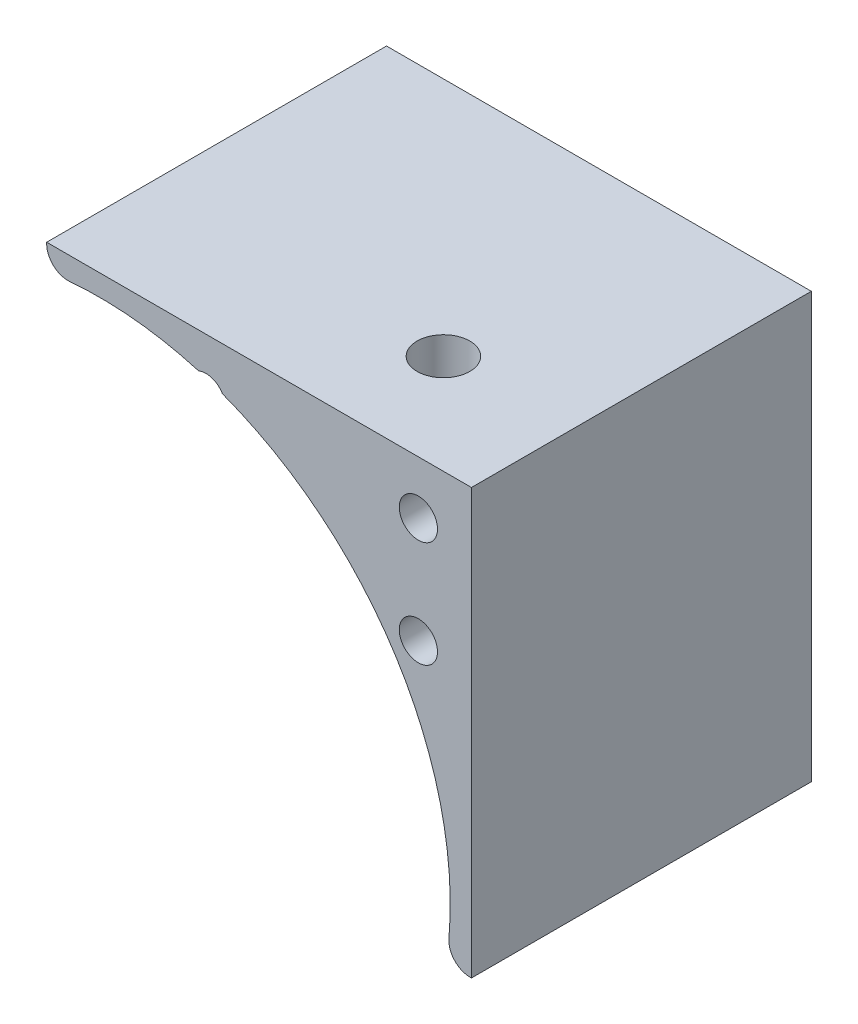
from build123d import *

# Parameters (mm, degrees)
SKETCH1_W           = 50.8
SKETCH1_H           = 50.8
BOSS_EXTRUDE1_DEPTH = 40.64
SKETCH2_R           = 41.91
CUT_EXTRUDE1_DEPTH  = 26.67
SKETCH3_R           = 29.21
CUT_EXTRUDE2_DEPTH  = 83.540230191
SKETCH4_R           = 2.286
CUT_EXTRUDE3_DEPTH  = 83.540230191
FILLET1_R           = 2.54
SKETCH5_R           = 3.154327094
CUT_EXTRUDE4_DEPTH  = 83.540230191


with BuildPart() as part:
    # Sketch1 → Boss-Extrude1 (new body)
    with BuildSketch(Plane.XY):
        with Locations((25.4, 25.4)):
            Rectangle(SKETCH1_W, SKETCH1_H)
    extrude(amount=BOSS_EXTRUDE1_DEPTH)

    # Sketch2 → Cut-Extrude1 (cut)
    with BuildSketch(Plane.XY.offset(40.64)):
        with Locations((6.35, 6.35)):
            Circle(SKETCH2_R)
    extrude(amount=-CUT_EXTRUDE1_DEPTH, mode=Mode.SUBTRACT)

    # Sketch3 → Cut-Extrude2 (cut, through all)
    with BuildSketch(Plane(origin=(0, 0, 0), x_dir=(-1, 0, 0), z_dir=(0, 0, -1))):
        with Locations((-6.35, 6.35)):
            Circle(SKETCH3_R)
    extrude(amount=-CUT_EXTRUDE2_DEPTH, mode=Mode.SUBTRACT)

    # Sketch4 → Cut-Extrude3 (cut, through all)
    with BuildSketch(Plane(origin=(0, 0, 0), x_dir=(-1, 0, 0), z_dir=(0, 0, -1))):
        with Locations((-6.35, 44.45)):
            Circle(SKETCH4_R)
        with Locations((-19.05, 44.45)):
            Circle(SKETCH4_R)
        with Locations((-44.45, 44.45)):
            Circle(SKETCH4_R)
        with Locations((-44.45, 31.75)):
            Circle(SKETCH4_R)
    extrude(amount=-CUT_EXTRUDE3_DEPTH, mode=Mode.SUBTRACT)

    # Fillet1
    fillet1_edges = [part.edges().sort_by_distance(p)[0] for p in [
        (0, 47.776146333, 27.305),
        (47.776146333, 0, 27.305),
        (0, 34.861429287, 6.985),
        (34.861429287, 0, 6.985),
    ]]
    fillet(fillet1_edges, radius=FILLET1_R)

    # Sketch5 → Cut-Extrude4 (cut, through all)
    with BuildSketch(Plane(origin=(0, 50.8, 0), x_dir=(1, 0, 0), z_dir=(0, 1, 0))):
        with Locations(Location((35.532091271, -28.724129848, 0), (0, 0, 270))):
            Circle(SKETCH5_R)
    extrude(amount=-CUT_EXTRUDE4_DEPTH, mode=Mode.SUBTRACT)


solid = part.part
